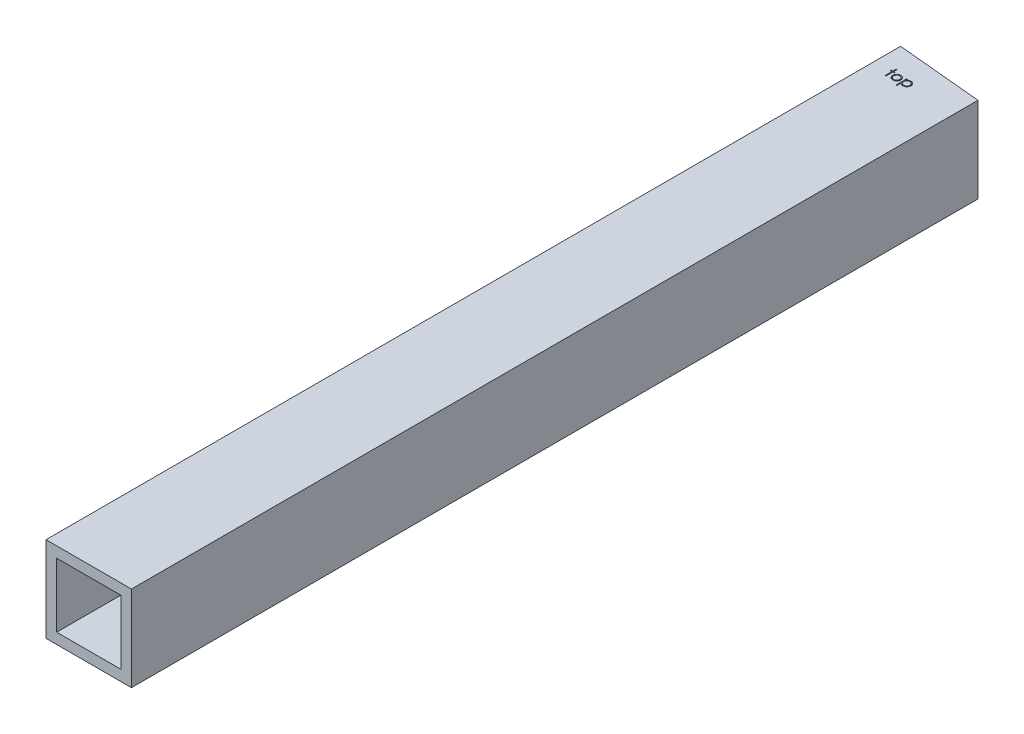
from build123d import *

# Parameters (mm, degrees)
SKETCH2_W           = 25.4
SKETCH2_H           = 25.4
SKETCH2_W_2         = 19.05
SKETCH2_H_2         = 19.05
BOSS_EXTRUDE1_DEPTH = 254
CUT_EXTRUDE1_DEPTH  = 257.527425434


with BuildPart() as part:
    # Sketch2 → Boss-Extrude1 (new body)
    with BuildSketch(Plane.XY):
        with Locations((12.7, 12.7)):
            Rectangle(SKETCH2_W, SKETCH2_H)
        with Locations((12.7, 12.7)):
            Rectangle(SKETCH2_W_2, SKETCH2_H_2, mode=Mode.SUBTRACT)
    extrude(amount=BOSS_EXTRUDE1_DEPTH)

    # Sketch3 → Cut-Extrude1 (cut, through all)
    # profile 1 of 4: a face of its own
    with BuildSketch(Plane(origin=(0, 25.4, 0), x_dir=(1, 0, 0), z_dir=(0, 1, 0))):
        Polygon((0, 0), (25.4, -2.39197226), (25.4, 0), align=None)
    # profile 2 of 4: a face of its own
    with BuildSketch(Plane(origin=(0, 25.4, 0), x_dir=(1, 0, 0), z_dir=(0, 1, 0))):
        Polygon((5.206442936, -6.540941157), (5.491378833, -6.540941157), (5.491378833, -7.477159106), (5.898430115, -7.477159106), (5.898430115, -7.762095003), (5.491378833, -7.762095003), (5.491378833, -9.797351414), (5.206442936, -9.797351414), (5.206442936, -7.762095003), (4.799391654, -7.762095003), (4.799391654, -7.477159106), (5.206442936, -7.477159106), align=None)
    # profile 3 of 4: a face of its own
    with BuildSketch(Plane(origin=(0, 25.4, 0), x_dir=(1, 0, 0), z_dir=(0, 1, 0))):
        with BuildLine():
            add(Edge.make_bspline(
                [(7.507554714, -7.436453978), (7.551089655, -7.437380979), (7.636451034, -7.439198602), (7.761462473, -7.458625035), (7.880792703, -7.488331573), (7.994898749, -7.529399347), (8.102319246, -7.584446545), (8.204618874, -7.650132116), (8.301517161, -7.727949183), (8.359595195, -7.788145431), (8.389075147, -7.818700572)],
                knots=[0, 0, 0, 0, 1.054011418, 2.066658804, 3.057071809, 4.030435133, 4.997543892, 5.974964718, 6.972108034, 8, 8, 8, 8], degree=3))
            add(Edge.make_bspline(
                [(8.389075147, -7.818700572), (8.414458777, -7.847923259), (8.464734793, -7.905803094), (8.529201552, -7.999652114), (8.584738253, -8.096843491), (8.629245368, -8.198667852), (8.664338211, -8.304236304), (8.689253521, -8.4139117), (8.704073455, -8.527451829), (8.706071861, -8.604562453), (8.707083961, -8.643615436)],
                knots=[0, 0, 0, 0, 1.025258237, 2.030674902, 3.01204498, 3.988269485, 4.97094183, 5.956517959, 6.965070386, 8, 8, 8, 8], degree=3))
            add(Edge.make_bspline(
                [(8.707083961, -8.643615436), (8.706193748, -8.682894774), (8.704434645, -8.760512578), (8.687794365, -8.874830145), (8.661912594, -8.985678306), (8.624872284, -9.092592978), (8.577375999, -9.195900972), (8.519418018, -9.295151063), (8.450591623, -9.390539069), (8.372573711, -9.481255023), (8.286348081, -9.564862946), (8.192807003, -9.637732162), (8.093788701, -9.700163116), (7.987976516, -9.750451865), (7.876336725, -9.790102807), (7.758628527, -9.817952108), (7.635034785, -9.834790207), (7.550645806, -9.836952448), (7.507554714, -9.838056542)],
                knots=[0, 0, 0, 0, 0.998656419, 1.973391657, 2.932242238, 3.890759089, 4.846373663, 5.82037756, 6.809684879, 7.83454468, 8.860553229, 9.859544525, 10.845671541, 11.83227036, 12.833544569, 13.85385346, 14.904124723, 16, 16, 16, 16], degree=3))
            add(Edge.make_bspline(
                [(7.507554714, -9.838056542), (7.464252505, -9.836948742), (7.379442939, -9.834779061), (7.255412941, -9.818017526), (7.137493787, -9.790115642), (7.025707844, -9.750321559), (6.919440733, -9.700161509), (6.819848696, -9.637920905), (6.72623163, -9.564841335), (6.639987758, -9.481260878), (6.561974738, -9.390537561), (6.49314708, -9.295151454), (6.435189427, -9.19590087), (6.387693057, -9.092593005), (6.350652769, -8.985678299), (6.324770992, -8.874830147), (6.308130713, -8.760512577), (6.30637161, -8.682894774), (6.305481397, -8.643615436)],
                knots=[0, 0, 0, 0, 1.099876186, 2.154163076, 3.173186993, 4.173200201, 5.163417411, 6.152872554, 7.150605724, 8.17532212, 9.198891216, 10.186952605, 11.159729845, 12.11414092, 13.071450619, 14.029093627, 15.002601286, 16, 16, 16, 16], degree=3))
            add(Edge.make_bspline(
                [(6.305481397, -8.643615436), (6.3065004, -8.604774712), (6.308517851, -8.527876754), (6.323322884, -8.414550064), (6.348141003, -8.305060289), (6.383275913, -8.199899322), (6.428193265, -8.098521176), (6.482949576, -8.001089651), (6.548073935, -7.907665003), (6.598149991, -7.849859974), (6.623490211, -7.820608625)],
                knots=[0, 0, 0, 0, 1.031353054, 2.041901799, 3.029428768, 4.008703097, 4.981709435, 5.96992636, 6.972712378, 8, 8, 8, 8], degree=3))
            add(Edge.make_bspline(
                [(6.623490211, -7.820608625), (6.652925719, -7.789788502), (6.710815824, -7.729175306), (6.808196456, -7.651585088), (6.910244422, -7.584532649), (7.018852033, -7.530579225), (7.13286434, -7.488089998), (7.252806082, -7.458548424), (7.378241728, -7.439268595), (7.464020813, -7.437401533), (7.507554714, -7.436453978)],
                knots=[0, 0, 0, 0, 1.027980169, 2.021703884, 2.998553061, 3.971491411, 4.943284454, 5.930300938, 6.949603206, 8, 8, 8, 8], degree=3))
        make_face()
        with BuildLine():
            add(Edge.make_bspline(
                [(7.506282679, -7.721389875), (7.475496418, -7.722264898), (7.414718637, -7.723992354), (7.325256585, -7.737131325), (7.239132302, -7.757947989), (7.156182394, -7.787524526), (7.076686587, -7.825714241), (7.000568772, -7.872621111), (6.927605059, -7.927623864), (6.859222758, -7.990636431), (6.796464518, -8.059469518), (6.741602354, -8.13281053), (6.694952436, -8.209469858), (6.656090292, -8.289527221), (6.627145914, -8.373793911), (6.606124672, -8.461315626), (6.592998097, -8.552270683), (6.591286882, -8.614102464), (6.590417295, -8.645523489)],
                knots=[0, 0, 0, 0, 1.021534396, 2.016698045, 2.994645724, 3.958388632, 4.93408049, 5.916473867, 6.921342795, 7.962252576, 8.998418191, 10.008913653, 10.997312074, 11.973003931, 12.956656626, 13.948281152, 14.957379055, 16, 16, 16, 16], degree=3))
            add(Edge.make_bspline(
                [(6.590417295, -8.645523489), (6.591874913, -8.686119971), (6.594768014, -8.766696396), (6.618294978, -8.885360771), (6.657652532, -8.999281451), (6.710799564, -9.107790602), (6.777389491, -9.208186168), (6.855845616, -9.2976953), (6.945325916, -9.374971001), (7.044763741, -9.439088625), (7.152128015, -9.490033546), (7.265753392, -9.526136903), (7.384263164, -9.549606224), (7.465253542, -9.551938918), (7.506282679, -9.553120644)],
                knots=[0, 0, 0, 0, 1.016792936, 2.018143844, 3.017858371, 4.030088057, 5.03801393, 6.028138512, 7.003788237, 7.991172063, 8.984598303, 9.972568034, 10.972917682, 12, 12, 12, 12], degree=3))
            add(Edge.make_bspline(
                [(7.506282679, -9.553120644), (7.547309457, -9.551932033), (7.628295176, -9.549585747), (7.746640286, -9.526255104), (7.859955104, -9.489875354), (7.967207862, -9.439145921), (8.066600424, -9.374727516), (8.15672427, -9.29813166), (8.23451051, -9.207949095), (8.301034566, -9.107657622), (8.355051968, -8.999449674), (8.394225301, -8.885339746), (8.417808826, -8.76670175), (8.420694292, -8.686121765), (8.422148064, -8.645523489)],
                knots=[0, 0, 0, 0, 1.02726834, 2.027799167, 3.010890988, 4.004497153, 4.992059811, 5.971914811, 6.958719428, 7.966827853, 8.981595046, 9.981490638, 10.983022906, 12, 12, 12, 12], degree=3))
            add(Edge.make_bspline(
                [(8.422148064, -8.645523489), (8.421278776, -8.614102276), (8.41956815, -8.552270125), (8.40643729, -8.461317757), (8.385431907, -8.373786094), (8.356429083, -8.289556063), (8.317735799, -8.209262577), (8.27018628, -8.13303561), (8.215548135, -8.059215457), (8.152032604, -7.99085894), (8.083721683, -7.9275993), (8.010728398, -7.872599783), (7.934723453, -7.825920392), (7.855458596, -7.787197874), (7.772498053, -7.758217072), (7.686494443, -7.737011128), (7.597414094, -7.724047878), (7.536854104, -7.722281543), (7.506282679, -7.721389875)],
                knots=[0, 0, 0, 0, 1.042956736, 2.052379634, 3.044323526, 4.02829302, 5.004299113, 5.996692471, 7.007513377, 8.048758398, 9.090003419, 10.095195979, 11.07790575, 12.047570684, 13.018257071, 13.989683339, 14.985167495, 16, 16, 16, 16], degree=3))
        make_face(mode=Mode.SUBTRACT)
    # profile 4 of 4: a face of its own
    with BuildSketch(Plane(origin=(0, 25.4, 0), x_dir=(1, 0, 0), z_dir=(0, 1, 0))):
        with BuildLine():
            Line((9.276955756, -7.477159106), (9.561891654, -7.477159106))
            Line((9.561891654, -7.477159106), (9.561891654, -7.906471005))
            add(Edge.make_bspline(
                [(9.561891654, -7.906471005), (9.592151657, -7.867520346), (9.650955918, -7.791827536), (9.752306367, -7.693865063), (9.85928283, -7.611246751), (9.974638211, -7.546492597), (10.096579701, -7.497669431), (10.224606875, -7.461583788), (10.359806326, -7.440319021), (10.452240965, -7.437759372), (10.499381638, -7.436453978)],
                knots=[0, 0, 0, 0, 1.0828784, 2.104357462, 3.088488658, 4.04616522, 5.001424249, 5.969181776, 6.964304535, 8, 8, 8, 8], degree=3))
            add(Edge.make_bspline(
                [(10.499381638, -7.436453978), (10.540558306, -7.437645219), (10.621946155, -7.439999769), (10.74174637, -7.45594104), (10.85711261, -7.483262089), (10.967392202, -7.52263292), (11.073766554, -7.571306096), (11.174660888, -7.632735121), (11.271646756, -7.703860737), (11.362285013, -7.785714188), (11.446033682, -7.874276973), (11.518465575, -7.969547206), (11.580942231, -8.068391838), (11.631443143, -8.172343235), (11.671002144, -8.280582823), (11.699136887, -8.393547908), (11.715880607, -8.510819654), (11.718127102, -8.590559979), (11.719263448, -8.630895083)],
                knots=[0, 0, 0, 0, 1.041296284, 2.058176809, 3.050446431, 4.034000596, 5.01514041, 6.003636468, 7.015969324, 8.052561599, 9.08815499, 10.094063707, 11.074456064, 12.040834395, 13.011057502, 13.983766392, 14.980127149, 16, 16, 16, 16], degree=3))
            add(Edge.make_bspline(
                [(11.719263448, -8.630895083), (11.718151758, -8.672081463), (11.715959344, -8.753306948), (11.698954946, -8.872584529), (11.671779781, -8.987326647), (11.632719858, -9.09734245), (11.582245079, -9.202556191), (11.520827371, -9.302891993), (11.448358933, -9.39831771), (11.365535767, -9.48753784), (11.275680604, -9.56972436), (11.179634595, -9.641604609), (11.078888284, -9.701967142), (10.973957104, -9.752388827), (10.863942775, -9.790391022), (10.749358587, -9.817802884), (10.630266926, -9.834707034), (10.549258024, -9.836931478), (10.508285884, -9.838056542)],
                knots=[0, 0, 0, 0, 1.038740735, 2.04854663, 3.033179607, 4.009277356, 4.987731542, 5.972001279, 6.972200261, 8.005528982, 9.039189865, 10.040446548, 11.026516639, 11.997840187, 12.972163198, 13.956796175, 14.96660207, 16, 16, 16, 16], degree=3))
            add(Edge.make_bspline(
                [(10.508285884, -9.838056542), (10.462178016, -9.836881966), (10.371101457, -9.834561835), (10.237934999, -9.811049227), (10.109776712, -9.775909293), (9.988046463, -9.724475206), (9.871779948, -9.658929131), (9.761634838, -9.579000587), (9.65702607, -9.484856734), (9.594062411, -9.41343573), (9.561891654, -9.376943761)],
                knots=[0, 0, 0, 0, 1.014726462, 2.004382257, 2.969841629, 3.936926163, 4.907207904, 5.903978561, 6.929055279, 8, 8, 8, 8], degree=3))
            Line((9.561891654, -9.376943761), (9.561891654, -10.652159106))
            Line((9.561891654, -10.652159106), (9.276955756, -10.652159106))
            Line((9.276955756, -10.652159106), (9.276955756, -7.477159106))
        make_face()
        with BuildLine():
            add(Edge.make_bspline(
                [(10.496837567, -7.721389875), (10.464561821, -7.721970681), (10.401019196, -7.723114137), (10.307880826, -7.736697648), (10.218168546, -7.756416885), (10.13278649, -7.78627268), (10.050916287, -7.822920175), (9.973188509, -7.868714571), (9.899657716, -7.922827462), (9.83050891, -7.984222295), (9.768040065, -8.051872191), (9.71273798, -8.124069703), (9.666285639, -8.200723401), (9.627730235, -8.281119266), (9.598390257, -8.365887489), (9.57756614, -8.454545293), (9.564475749, -8.547189718), (9.562762213, -8.610286953), (9.561891654, -8.642343401)],
                knots=[0, 0, 0, 0, 1.05670511, 2.080379991, 3.077984906, 4.06214886, 5.038337365, 6.01289324, 7.01187578, 8.025460281, 9.038092164, 10.024533457, 11.000252242, 11.969694649, 12.940728589, 13.933144304, 14.949937299, 16, 16, 16, 16], degree=3))
            add(Edge.make_bspline(
                [(9.561891654, -8.642343401), (9.563334787, -8.684424046), (9.566162009, -8.766863593), (9.589146621, -8.887317761), (9.626552896, -9.001301763), (9.679646801, -9.107855703), (9.746727815, -9.205811561), (9.827552571, -9.293523754), (9.921389742, -9.370440933), (10.026679266, -9.435230213), (10.139547913, -9.487833673), (10.257282276, -9.525492993), (10.378263275, -9.548690657), (10.460058822, -9.551635986), (10.50128969, -9.553120644)],
                knots=[0, 0, 0, 0, 1.03728447, 2.032128127, 3.01272805, 3.987917167, 4.958271349, 5.931593992, 6.91984656, 7.941419022, 8.973179163, 9.983609215, 10.983593296, 12, 12, 12, 12], degree=3))
            add(Edge.make_bspline(
                [(10.50128969, -9.553120644), (10.541689994, -9.551708788), (10.621877334, -9.548906508), (10.739949344, -9.524651152), (10.854694424, -9.487598879), (10.963715009, -9.433569853), (11.06606203, -9.367357443), (11.158483153, -9.287927985), (11.239225139, -9.195862108), (11.308044947, -9.093347251), (11.363499937, -8.983423868), (11.405165226, -8.869685037), (11.429212289, -8.752531689), (11.432620233, -8.673612335), (11.434327551, -8.634075172)],
                knots=[0, 0, 0, 0, 1.00104056, 1.986885549, 2.97790532, 3.984399681, 4.995088187, 5.994304198, 6.996462723, 8.023150851, 9.048424203, 10.043036403, 11.019596776, 12, 12, 12, 12], degree=3))
            add(Edge.make_bspline(
                [(11.434327551, -8.634075172), (11.4330079, -8.594292431), (11.430378878, -8.515036899), (11.404482637, -8.398230551), (11.365566229, -8.284032173), (11.308816231, -8.17560996), (11.24150508, -8.073307756), (11.160091733, -7.982998166), (11.068818469, -7.903921913), (10.966593298, -7.838593648), (10.856883055, -7.786627521), (10.741390239, -7.748633077), (10.620700685, -7.72579689), (10.538488456, -7.722871802), (10.496837567, -7.721389875)],
                knots=[0, 0, 0, 0, 0.983928682, 1.960191568, 2.949917689, 3.96440592, 4.982380491, 5.975291189, 6.965713506, 7.964880129, 8.970154049, 9.96478489, 10.968906225, 12, 12, 12, 12], degree=3))
        make_face(mode=Mode.SUBTRACT)
    extrude(amount=-CUT_EXTRUDE1_DEPTH, mode=Mode.SUBTRACT)


with BuildPart() as cut_extrude1_piece_1:
    # of the separate pieces the step leaves, piece 1, a body of its own (cut_extrude1_pieces)
    add(part.part.solids().sort_by_distance((0, 0, 0))[0])


with BuildPart() as cut_extrude1_piece_2:
    # of the separate pieces the step leaves, piece 2, a body of its own (cut_extrude1_pieces)
    add(part.part.solids().sort_by_distance((9.561891654, 0, 8.642343401))[0])


with BuildPart() as cut_extrude1_piece_3:
    # of the separate pieces the step leaves, piece 3, a body of its own (cut_extrude1_pieces)
    add(part.part.solids().sort_by_distance((10.496837567, 25.4, 7.721389875))[0])


with BuildPart() as cut_extrude1_piece_4:
    # of the separate pieces the step leaves, piece 4, a body of its own (cut_extrude1_pieces)
    add(part.part.solids().sort_by_distance((6.590417295, 0, 8.645523489))[0])


with BuildPart() as cut_extrude1_piece_5:
    # of the separate pieces the step leaves, piece 5, a body of its own (cut_extrude1_pieces)
    add(part.part.solids().sort_by_distance((7.506282679, 25.4, 7.721389875))[0])


solid = Compound([cut_extrude1_piece_1.part, cut_extrude1_piece_2.part, cut_extrude1_piece_3.part, cut_extrude1_piece_4.part, cut_extrude1_piece_5.part])
